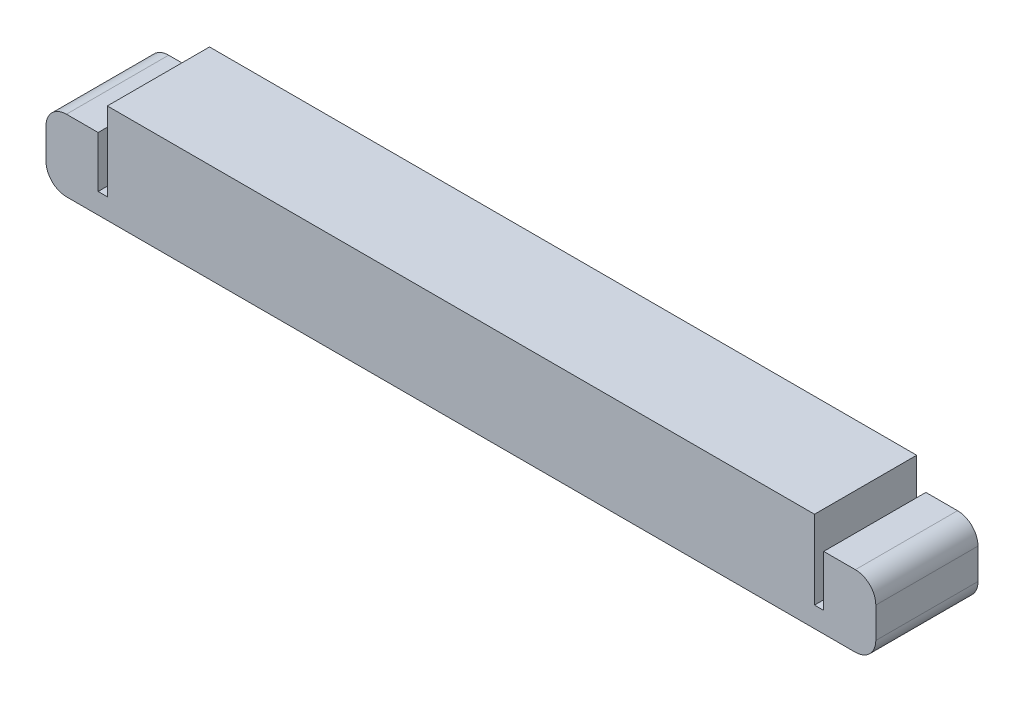
from build123d import *

# Parameters (mm, degrees)
BOSS_EXTRUDE1_DEPTH      = 19.25
BOSS_EXTRUDE1_DEPTH_BACK = 5
SKETCH1_W                = 173
SKETCH1_H                = 25
SKETCH2_W                = 15
SKETCH2_H                = 25
BOSS_EXTRUDE2_DEPTH      = 5
SKETCH3_W                = 12.75
SKETCH3_H                = 25
BOSS_EXTRUDE3_DEPTH      = 12.5
FILLET1_R                = 5


with BuildPart() as part:
    # Sketch1 → Boss-Extrude1 (new, two sides: drawn at the far end of the back side and taken through both)
    with BuildSketch(Plane(origin=(0, 0, 0), x_dir=(1, 0, 0), z_dir=(0, 1, 0)).offset(-BOSS_EXTRUDE1_DEPTH_BACK)):
        with Locations((0, 75)):
            Rectangle(SKETCH1_W, SKETCH1_H)
    extrude(amount=BOSS_EXTRUDE1_DEPTH + BOSS_EXTRUDE1_DEPTH_BACK)

    # Sketch2 → Boss-Extrude2 (add)
    with BuildSketch(Plane(origin=(0, -5, 0), x_dir=(1, 0, 0), z_dir=(0, 1, 0))):
        with Locations((-94, 75)):
            Rectangle(SKETCH2_W, SKETCH2_H)
        with Locations((94, 75)):
            Rectangle(SKETCH2_W, SKETCH2_H)
    extrude(amount=BOSS_EXTRUDE2_DEPTH)

    # Sketch3 → Boss-Extrude3 (add)
    with BuildSketch(Plane(origin=(0, 0, 0), x_dir=(1, 0, 0), z_dir=(0, 1, 0))):
        with Locations((-95.125, 75)):
            Rectangle(SKETCH3_W, SKETCH3_H)
        with Locations((95.125, 75)):
            Rectangle(SKETCH3_W, SKETCH3_H)
    extrude(amount=BOSS_EXTRUDE3_DEPTH)

    # Fillet1
    fillet1_edges = [part.edges().sort_by_distance(p)[0] for p in [
        (-101.5, -5, -75),
        (101.5, -5, -75),
        (-101.5, 12.5, -75),
        (101.5, 12.5, -75),
    ]]
    fillet(fillet1_edges, radius=FILLET1_R)


solid = part.part
